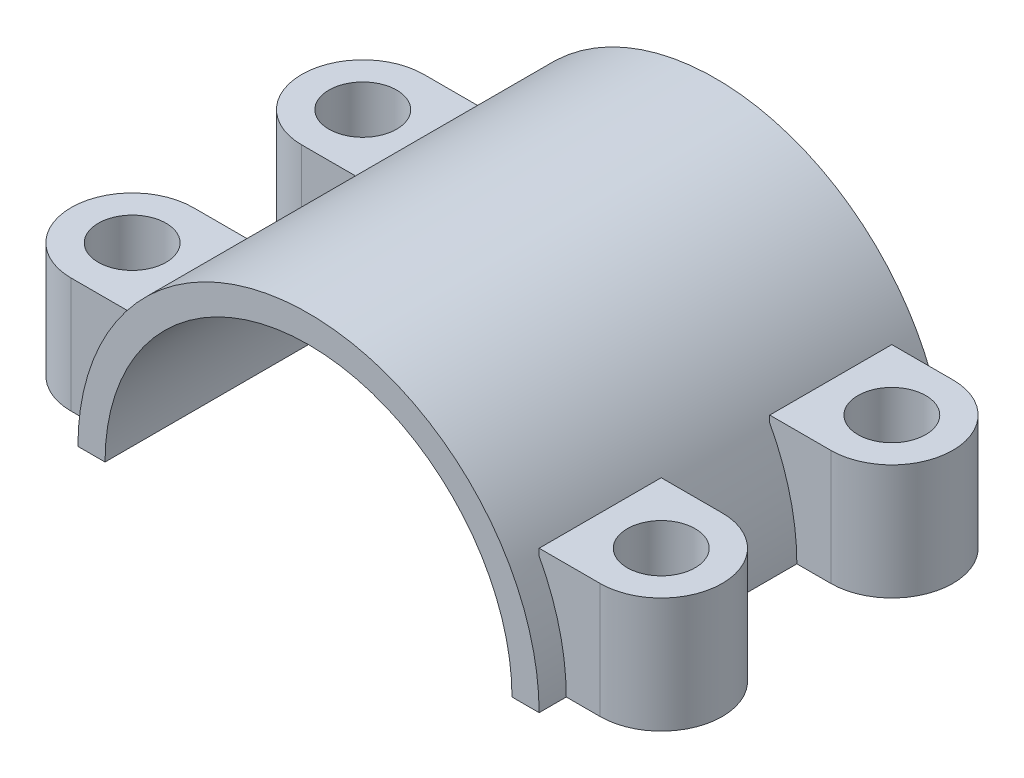
from build123d import *

# Parameters (mm, degrees)
BOSS_EXTRUDE2_DEPTH = 38.1
SKETCH8_R           = 5.715
BOSS_EXTRUDE3_DEPTH = 10.795
SKETCH9_W           = 5.715
SKETCH9_H           = 11.43
BOSS_EXTRUDE4_DEPTH = 10.795
SKETCH10_R          = 3.175
CUT_EXTRUDE1_DEPTH  = 10.795


with BuildPart() as part:
    # Sketch1 → Boss-Extrude2 (new body)
    with BuildSketch(Plane.XY):
        with BuildLine():
            Line((-21.59, 0), (-19.05, 0))
            ThreePointArc((-19.05, 0), (0, 19.05), (19.05, 0))
            Line((19.05, 0), (21.59, 0))
            ThreePointArc((21.59, 0), (0, 21.59), (-21.59, 0))
        make_face()
    extrude(amount=BOSS_EXTRUDE2_DEPTH)

    # Sketch8 → Boss-Extrude3 (add)
    with BuildSketch(Plane(origin=(0, 0, 0), x_dir=(1, 0, 0), z_dir=(0, 1, 0))):
        with Locations(Location((-24.765, -8.255, 0), (0, 0, 56.251011404))):
            Circle(SKETCH8_R)
        with Locations(Location((-24.765, -29.845, 0), (0, 0, 56.251011404))):
            Circle(SKETCH8_R)
    boss_extrude3 = extrude(amount=BOSS_EXTRUDE3_DEPTH)

    # Sketch9 → Boss-Extrude4 (add)
    with BuildSketch(Plane(origin=(0, 0, 0), x_dir=(1, 0, 0), z_dir=(0, 1, 0))):
        with Locations((-21.9075, -29.845)):
            Rectangle(SKETCH9_W, SKETCH9_H)
        with Locations((-21.9075, -8.255)):
            Rectangle(SKETCH9_W, SKETCH9_H)
    boss_extrude4 = extrude(amount=BOSS_EXTRUDE4_DEPTH)

    # Sketch10 → Cut-Extrude1 (cut)
    with BuildSketch(Plane(origin=(0, 10.795, 0), x_dir=(1, 0, 0), z_dir=(0, 1, 0))):
        with Locations(Location((-24.765, -29.845, 0), (0, 0, 270))):
            Circle(SKETCH10_R)
        with Locations(Location((-24.765, -8.255, 0), (0, 0, 270))):
            Circle(SKETCH10_R)
    cut_extrude1 = extrude(amount=-CUT_EXTRUDE1_DEPTH, mode=Mode.SUBTRACT)

    # Mirror1: Boss-Extrude3, Boss-Extrude4, Cut-Extrude1 across plane
    add(boss_extrude3.mirror(Plane(origin=(0, 0, 0), x_dir=(0, 0, 1), z_dir=(1, 0, 0))))
    add(boss_extrude4.mirror(Plane(origin=(0, 0, 0), x_dir=(0, 0, 1), z_dir=(1, 0, 0))))
    add(cut_extrude1.mirror(Plane(origin=(0, 0, 0), x_dir=(0, 0, 1), z_dir=(1, 0, 0))), mode=Mode.SUBTRACT)


solid = part.part
